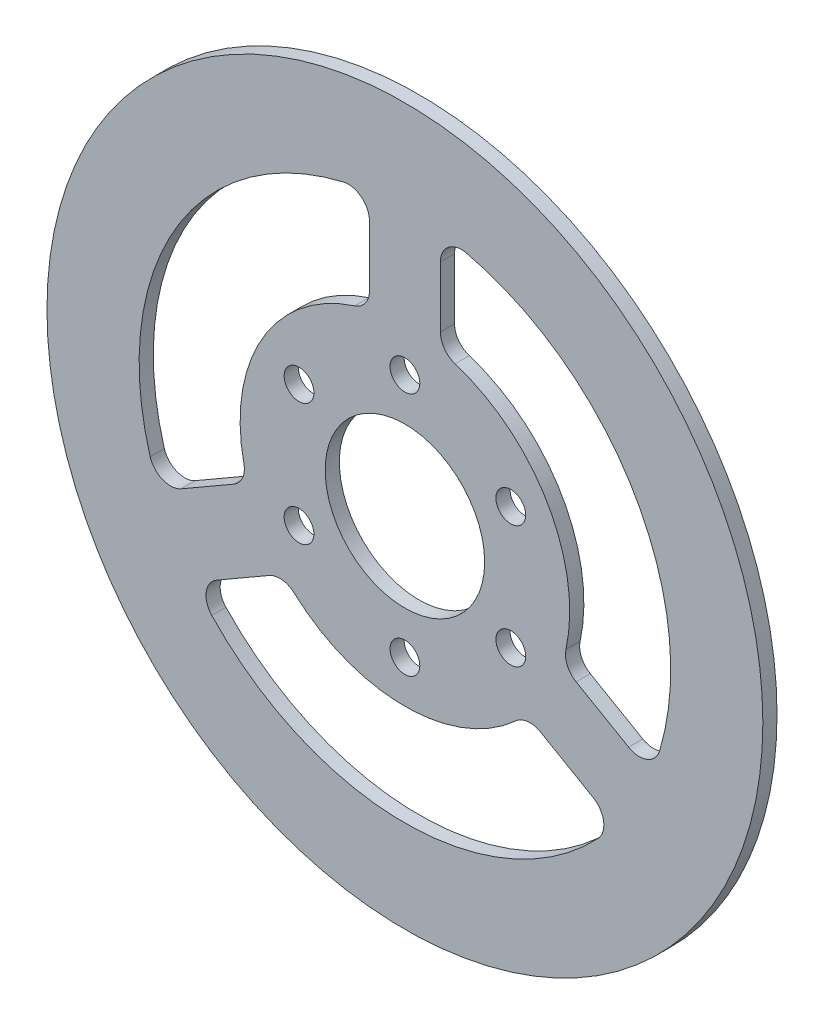
from build123d import *

# Parameters (mm, degrees)
SKETCH_1_R          = 50.5
EXTRUDE_1_DEPTH     = 2
SKETCH_2_R          = 11.25
SKETCH_2_R_2        = 2.1
CUT_EXTRUDE_1_DEPTH = 10
FILLET_1_R          = 3


with BuildPart() as part:
    # 草图1 → 凸台-拉伸1 (new body)
    with BuildSketch(Plane.XY):
        Circle(SKETCH_1_R)
    extrude(amount=EXTRUDE_1_DEPTH)

    # 草图2 → 切除-拉伸1 (cut)
    with BuildSketch(Plane.XY.offset(2)):
        with BuildLine():
            Line((-5, 22.706001409), (-5, 37.165171868))
            ThreePointArc((-5, 37.165171868), (-32.475952642, 18.75), (-34.685982974, -14.252458915))
            Line((-34.685982974, -14.252458915), (-22.163974039, -7.022873686))
            ThreePointArc((-22.163974039, -7.022873686), (-20.135090638, 11.625), (-5, 22.706001409))
        make_face()
        with BuildLine():
            ThreePointArc((37.5, 0), (28.228974477, 24.685522073), (5, 37.165171868))
            Line((5, 37.165171868), (5, 22.706001409))
            ThreePointArc((5, 22.706001409), (18.121982507, 14.565584437), (23.25, 0))
            ThreePointArc((23.25, 0), (22.976889437, -3.55317489), (22.163974039, -7.022873686))
            Line((22.163974039, -7.022873686), (34.685982974, -14.252458915))
            ThreePointArc((34.685982974, -14.252458915), (36.789770056, -7.263801982), (37.5, 0))
        make_face()
        with BuildLine():
            Line((-17.163974039, -15.683127724), (-29.685982974, -22.912712953))
            ThreePointArc((-29.685982974, -22.912712953), (0, -37.5), (29.685982974, -22.912712953))
            Line((29.685982974, -22.912712953), (17.163974039, -15.683127724))
            ThreePointArc((17.163974039, -15.683127724), (0, -23.25), (-17.163974039, -15.683127724))
        make_face()
        Circle(SKETCH_2_R)
        with Locations((-14.938938215, -8.625)):
            Circle(SKETCH_2_R_2)
        with Locations((-14.938938215, 8.625)):
            Circle(SKETCH_2_R_2)
        with Locations((0, 17.25)):
            Circle(SKETCH_2_R_2)
        with Locations((14.938938215, 8.625)):
            Circle(SKETCH_2_R_2)
        with Locations((14.938938215, -8.625)):
            Circle(SKETCH_2_R_2)
        with Locations((0, -17.25)):
            Circle(SKETCH_2_R_2)
    extrude(amount=-CUT_EXTRUDE_1_DEPTH, mode=Mode.SUBTRACT)

    # 圆角1
    fillet_1_edges = [part.edges().sort_by_distance(p)[0] for p in [
        (34.685982974, -14.252458915, 1),
        (22.163974039, -7.022873686, 1),
        (5, 22.706001409, 1),
        (5, 37.165171868, 1),
        (-29.685982974, -22.912712953, 1),
        (-17.163974039, -15.683127724, 1),
        (17.163974039, -15.683127724, 1),
        (29.685982974, -22.912712953, 1),
        (-5, 37.165171868, 1),
        (-5, 22.706001409, 1),
        (-22.163974039, -7.022873686, 1),
        (-34.685982974, -14.252458915, 1),
    ]]
    fillet(fillet_1_edges, radius=FILLET_1_R)


solid = part.part
